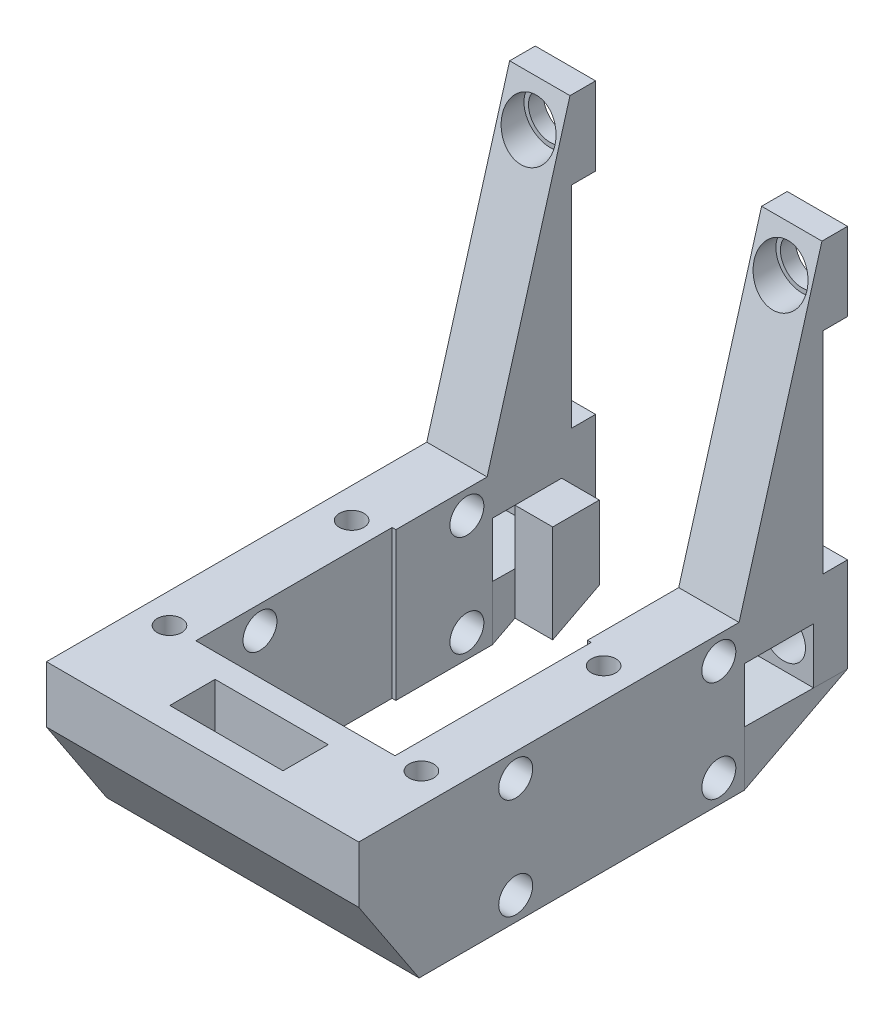
from build123d import *

# Parameters (mm, degrees)
SKETCH1_W             = 7.5
SKETCH1_H             = 7.5
BOSS_EXTRUDE1_DEPTH   = 5.5
BOSS_EXTRUDE1_2_DEPTH = 5.5
BOSS_EXTRUDE1_3_DEPTH = 5.5
BOSS_EXTRUDE1_4_DEPTH = 5.5
BOSS_EXTRUDE2_START   = -5.5
SKETCH2_W             = 8
SKETCH2_H             = 7.5
BOSS_EXTRUDE2_DEPTH   = 50.5
SKETCH3_W             = 41.4
SKETCH3_H             = 7.5
BOSS_EXTRUDE3_DEPTH   = 16
BOSS_EXTRUDE4_DEPTH   = 8
SKETCH5_R             = 2.5
CUT_EXTRUDE1_DEPTH    = 8
SKETCH6_W             = 38.1096
SKETCH6_H             = 12.112327922
BOSS_EXTRUDE6_DEPTH   = 8
SKETCH9_W             = 41.4
SKETCH9_H             = 12.112327922
BOSS_EXTRUDE7_DEPTH   = 8
SKETCH10_R            = 2.25
CUT_EXTRUDE2_DEPTH    = 5606.052393737
BOSS_EXTRUDE8_DEPTH   = 8
BOSS_EXTRUDE9_DEPTH   = 8
SKETCH13_W            = 4.925533285
SKETCH13_H            = 27.926
CUT_EXTRUDE3_DEPTH    = 5606.052393737
BOSS_EXTRUDE10_DEPTH  = 41.4
SKETCH16_W            = 26.4
SKETCH16_H            = 26.013663936
CUT_EXTRUDE5_DEPTH    = 5601.464404158
SKETCH17_W            = 25.4
SKETCH17_H            = 5.5
CUT_EXTRUDE6_DEPTH    = 50
SKETCH18_W            = 41.4
SKETCH18_H            = 1.703308899
CUT_EXTRUDE7_DEPTH    = 50
SKETCH19_R            = 2.9
CUT_EXTRUDE8_DEPTH    = 50
SKETCH20_R            = 3.5
CUT_EXTRUDE9_DEPTH    = 8
SKETCH21_W            = 10.687091101
SKETCH21_H            = 14.528220305
CUT_EXTRUDE10_DEPTH   = 55
SKETCH22_W            = 8
SKETCH22_H            = 4.5
BOSS_EXTRUDE11_DEPTH  = 7.42786537
SKETCH23_R            = 2.9
CUT_EXTRUDE11_DEPTH   = 5
SKETCH25_W            = 6.187091101
SKETCH25_H            = 14.528220305
BOSS_EXTRUDE12_DEPTH  = 5
SKETCH26_W            = 3
SKETCH26_H            = 14.528220305
CUT_EXTRUDE12_DEPTH   = 5606.052393737
BOSS_EXTRUDE15_DEPTH  = 8
CUT_EXTRUDE13_DEPTH   = 5605.999013072
SKETCH29_W            = 15
SKETCH29_H            = 6
CUT_EXTRUDE14_DEPTH   = 10
SKETCH30_R            = 1.625
CUT_EXTRUDE15_DEPTH   = 10
SKETCH31_R            = 1.625
CUT_EXTRUDE16_DEPTH   = 10


with BuildPart() as part:
    # Sketch1 → Boss-Extrude1 (new body)
    with BuildSketch(Plane(origin=(-474.147028746, -1016.113518437, 5527.294851894), x_dir=(1, 0, 0), z_dir=(0, 0, 1))):
        with Locations((215.351694909, 679.332213979)):
            Rectangle(SKETCH1_W, SKETCH1_H)
    extrude(amount=BOSS_EXTRUDE1_DEPTH)

    # Sketch2 → Boss-Extrude2 (add)
    with BuildSketch(Plane.XY.offset(5532.794851894).offset(BOSS_EXTRUDE2_START)):
        with Locations((-233.145333837, -336.781304458)):
            Rectangle(SKETCH2_W, SKETCH2_H)
        with Locations((-266.545333837, -336.781304458)):
            Rectangle(SKETCH2_W, SKETCH2_H)
    boss_extrude2 = extrude(amount=BOSS_EXTRUDE2_DEPTH)


with BuildPart() as body_2:
    # Sketch1 → Boss-Extrude1 2 (new body)
    with BuildSketch(Plane(origin=(-474.147028746, -1016.113518437, 5527.294851894), x_dir=(1, 0, 0), z_dir=(0, 0, 1))):
        with Locations((233.251694909, 679.332213979)):
            Rectangle(SKETCH1_W, SKETCH1_H)
    extrude(amount=BOSS_EXTRUDE1_2_DEPTH)


with BuildPart() as body_3:
    # Sketch1 → Boss-Extrude1 3 (new body)
    with BuildSketch(Plane(origin=(-474.147028746, -1016.113518437, 5527.294851894), x_dir=(1, 0, 0), z_dir=(0, 0, 1))):
        with Locations((233.251694909, 714.758213979)):
            Rectangle(SKETCH1_W, SKETCH1_H)
    extrude(amount=BOSS_EXTRUDE1_3_DEPTH)


with BuildPart() as body_4:
    # Sketch1 → Boss-Extrude1 4 (new body)
    with BuildSketch(Plane(origin=(-474.147028746, -1016.113518437, 5527.294851894), x_dir=(1, 0, 0), z_dir=(0, 0, 1))):
        with Locations((215.351694909, 714.758213979)):
            Rectangle(SKETCH1_W, SKETCH1_H)
    extrude(amount=BOSS_EXTRUDE1_4_DEPTH)



with BuildPart() as boss_extrude2_piece_1:
    # of the separate pieces the step leaves, piece 1, a body of its own (boss_extrude2_pieces)
    add(part.part.solids().sort_by_distance((-255.045333837, -333.031304458, 5527.294851894))[0])



with BuildPart() as boss_extrude2_piece_2:
    # of the separate pieces the step leaves, piece 2, a body of its own (boss_extrude2_pieces)
    add(part.part.solids().sort_by_distance((-229.145333837, -333.031304458, 5527.294851894))[0])


with BuildPart() as boss_extrude2_piece_1_1:
    add(boss_extrude2_piece_1.part)

    add(boss_extrude2_piece_2.part)  # Boss-Extrude3 merges Boss-Extrude2 piece 2
    # Sketch3 → Boss-Extrude3 (add)
    with BuildSketch(Plane.XY.offset(5577.794851894)):
        with Locations((-249.845333837, -336.781304458)):
            Rectangle(SKETCH3_W, SKETCH3_H)
    extrude(amount=BOSS_EXTRUDE3_DEPTH)


with BuildPart() as body_4_1:
    add(body_4.part)

    add(boss_extrude2_piece_1_1.part)  # Boss-Extrude4 merges Boss-Extrude2 piece 1
    # Sketch4 → Boss-Extrude4 (add)
    with BuildSketch(Plane.ZY.offset(262.545333837)):
        Polygon((5527.294851894, -333.031304458), (5527.294851894, -294.74397633), (5532.394065696, -294.74397633), (5543.378858785, -333.031304458), align=None)
    boss_extrude4 = extrude(amount=BOSS_EXTRUDE4_DEPTH)

    # Mirror1: Boss-Extrude2, Boss-Extrude4 across plane
    add(boss_extrude2.mirror(Plane.ZY.offset(249.845333837)))
    add(boss_extrude4.mirror(Plane.ZY.offset(249.845333837)))


with BuildPart() as cut_extrude1_tool:
    # Sketch5 → Cut-Extrude1 (new body)
    with BuildSketch(Plane.XY.offset(5532.794851894)):
        with Locations((-258.795333837, -301.355304458)):
            Circle(SKETCH5_R)
        with Locations((-240.895333837, -301.355304458)):
            Circle(SKETCH5_R)
        with Locations((-240.895333837, -336.781304458)):
            Circle(SKETCH5_R)
        with Locations(Location((-258.795333837, -336.781304458, 0), (0, 0, 180))):
            Circle(SKETCH5_R)
    extrude(amount=-CUT_EXTRUDE1_DEPTH)


with BuildPart() as body_2_1:
    add(body_2.part)

    # Cut-Extrude1: cut by cut_extrude1_tool
    add(cut_extrude1_tool.part, mode=Mode.SUBTRACT)



with BuildPart() as body_3_1:
    add(body_3.part)

    # Cut-Extrude1: cut by cut_extrude1_tool
    add(cut_extrude1_tool.part, mode=Mode.SUBTRACT)


with BuildPart() as body_4_2:
    add(body_4_1.part)

    # Cut-Extrude1: cut by cut_extrude1_tool
    add(cut_extrude1_tool.part, mode=Mode.SUBTRACT)

    # Sketch6 → Boss-Extrude6 (add)
    with BuildSketch(Plane.ZY.offset(270.545333837)):
        with Locations((5558.740051894, -346.587468419)):
            Rectangle(SKETCH6_W, SKETCH6_H)
    boss_extrude6 = extrude(amount=-BOSS_EXTRUDE6_DEPTH)

    # Mirror2: Boss-Extrude6 across plane
    add(boss_extrude6.mirror(Plane.ZY.offset(249.845333837)))

    # Sketch9 → Boss-Extrude7 (add)
    with BuildSketch(Plane.XY.offset(5577.794851894)):
        with Locations((-249.845333837, -346.587468419)):
            Rectangle(SKETCH9_W, SKETCH9_H)
    extrude(amount=BOSS_EXTRUDE7_DEPTH)

    # Sketch10 → Cut-Extrude2 (cut, through all)
    with BuildSketch(Plane.ZY.offset(270.545333837)):
        with Locations((5546.061207304, -349.537271609)):
            Circle(SKETCH10_R)
        with Locations((5572.989599872, -349.537271609)):
            Circle(SKETCH10_R)
        with Locations((5546.061207304, -336.137665229)):
            Circle(SKETCH10_R)
        with Locations((5572.989599872, -336.137665229)):
            Circle(SKETCH10_R)
    extrude(amount=-CUT_EXTRUDE2_DEPTH, mode=Mode.SUBTRACT)

    # Sketch11 → Boss-Extrude8 (add)
    with BuildSketch(Plane.ZY.offset(270.545333837)):
        Polygon((5527.294851894, -340.372465198), (5539.685251894, -352.64363238), (5539.685251894, -340.531304458), align=None)
    extrude(amount=-BOSS_EXTRUDE8_DEPTH)


with BuildPart() as body_2_2:
    add(body_2_1.part)

    add(body_4_2.part)  # Boss-Extrude9 merges body 4
    # Sketch12 → Boss-Extrude9 (add)
    with BuildSketch(Plane(origin=(-229.145333837, 0, 0), x_dir=(0, 0, -1), z_dir=(1, 0, 0))):
        Polygon((-5539.685251894, -352.64363238), (-5531.24028041, -340.531304458), (-5539.685251894, -340.531304458), align=None)
    extrude(amount=-BOSS_EXTRUDE9_DEPTH)

    # Sketch13 → Cut-Extrude3 (cut, through all)
    with BuildSketch(Plane.ZY.offset(270.545333837)):
        with Locations((5529.757618536, -319.068304458)):
            Rectangle(SKETCH13_W, SKETCH13_H)
    extrude(amount=-CUT_EXTRUDE3_DEPTH, mode=Mode.SUBTRACT)

    # Sketch14 → Boss-Extrude10 (add)
    with BuildSketch(Plane.ZY.offset(270.545333837)):
        Polygon((5585.794851894, -352.64363238), (5593.794851894, -340.531304458), (5585.794851894, -340.531304458), align=None)
    extrude(amount=-BOSS_EXTRUDE10_DEPTH)

    # Sketch16 → Cut-Extrude5 (cut, through all)
    with BuildSketch(Plane(origin=(0, -333.031304458, 0), x_dir=(1, 0, 0), z_dir=(0, 1, 0))):
        with Locations((-249.845333837, -5568.481626817)):
            Rectangle(SKETCH16_W, SKETCH16_H)
    extrude(amount=-CUT_EXTRUDE5_DEPTH, mode=Mode.SUBTRACT)


with BuildPart() as cut_extrude6_tool:
    # Sketch17 → Cut-Extrude6 (new body)
    with BuildSketch(Plane(origin=(0, -297.605304458, 0), x_dir=(1, 0, 0), z_dir=(0, 1, 0))):
        with Locations((-249.845333837, -5530.044851894)):
            Rectangle(SKETCH17_W, SKETCH17_H)
    extrude(amount=-CUT_EXTRUDE6_DEPTH)


with BuildPart() as body_2_3:
    add(body_2_2.part)

    # Cut-Extrude6: cut by cut_extrude6_tool
    add(cut_extrude6_tool.part, mode=Mode.SUBTRACT)

    # Sketch18 → Cut-Extrude7 (cut)
    with BuildSketch(Plane(origin=(0, -294.74397633, 0), x_dir=(1, 0, 0), z_dir=(0, 1, 0))):
        with Locations((-249.845333837, -5528.146506344)):
            Rectangle(SKETCH18_W, SKETCH18_H)
    extrude(amount=-CUT_EXTRUDE7_DEPTH, mode=Mode.SUBTRACT)

    # Sketch19 → Cut-Extrude8 (cut)
    with BuildSketch(Plane(origin=(0, 0, 5528.998160793), x_dir=(-1, 0, 0), z_dir=(0, 0, -1))):
        with Locations((233.145333837, -299.924640394)):
            Circle(SKETCH19_R)
    cut_extrude8 = extrude(amount=-CUT_EXTRUDE8_DEPTH, mode=Mode.SUBTRACT)

    # Sketch20 → Cut-Extrude9 (cut)
    with BuildSketch(Plane(origin=(0, 0, 5538.998160793), x_dir=(-1, 0, 0), z_dir=(0, 0, -1))):
        with Locations(Location((233.145333837, -299.924640394, 0), (0, 0, 270))):
            Circle(SKETCH20_R)
    cut_extrude9 = extrude(amount=CUT_EXTRUDE9_DEPTH, mode=Mode.SUBTRACT)

    # Mirror3: Cut-Extrude8, Cut-Extrude9 across plane
    add(cut_extrude8.mirror(Plane.ZY.offset(249.845333837)), mode=Mode.SUBTRACT)
    add(cut_extrude9.mirror(Plane.ZY.offset(249.845333837)), mode=Mode.SUBTRACT)

    # Sketch21 → Cut-Extrude10 (cut)
    with BuildSketch(Plane.ZY.offset(270.545333837)):
        with Locations((5534.341706344, -345.379522228)):
            Rectangle(SKETCH21_W, SKETCH21_H)
    extrude(amount=-CUT_EXTRUDE10_DEPTH, mode=Mode.SUBTRACT)

    # Sketch22 → Boss-Extrude11 (add)
    with BuildSketch(Plane.XZ.offset(338.115412075)):
        with Locations((-266.545333837, 5531.248160793)):
            Rectangle(SKETCH22_W, SKETCH22_H)
    boss_extrude11 = extrude(amount=BOSS_EXTRUDE11_DEPTH)

    # Mirror5: Boss-Extrude11 across plane
    add(boss_extrude11.mirror(Plane.ZY.offset(249.845333837)))

    # Sketch23 → Cut-Extrude11 (cut)
    with BuildSketch(Plane(origin=(0, 0, 5528.998160793), x_dir=(-1, 0, 0), z_dir=(0, 0, -1))):
        with Locations((233.118864035, -341.469886082)):
            Circle(SKETCH23_R)
    cut_extrude11 = extrude(amount=-CUT_EXTRUDE11_DEPTH, mode=Mode.SUBTRACT)

    # Sketch26 → Cut-Extrude12 (cut, through all)
    with BuildSketch(Plane.ZY.offset(270.545333837)):
        with Locations((5541.185251894, -345.379522228)):
            Rectangle(SKETCH26_W, SKETCH26_H)
    extrude(amount=-CUT_EXTRUDE12_DEPTH, mode=Mode.SUBTRACT)

    # Mirror6: Cut-Extrude11 across plane
    add(cut_extrude11.mirror(Plane.ZY.offset(249.845333837)), mode=Mode.SUBTRACT)

    # Sketch29 → Cut-Extrude14 (cut)
    with BuildSketch(Plane(origin=(0, -333.031304458, 0), x_dir=(1, 0, 0), z_dir=(0, 1, 0))):
        with Locations((-249.845333837, -5587.64165534)):
            Rectangle(SKETCH29_W, SKETCH29_H)
    extrude(amount=-CUT_EXTRUDE14_DEPTH, mode=Mode.SUBTRACT)

    # Sketch30 → Cut-Extrude15 (cut)
    with BuildSketch(Plane(origin=(0, -333.031304458, 0), x_dir=(1, 0, 0), z_dir=(0, 1, 0))):
        with Locations(Location((-266.545333837, -5557.335586136, 0), (0, 0, 270))):
            Circle(SKETCH30_R)
    cut_extrude15 = extrude(amount=-CUT_EXTRUDE15_DEPTH, mode=Mode.SUBTRACT)

    # Sketch31 → Cut-Extrude16 (cut)
    with BuildSketch(Plane(origin=(0, -333.031304458, 0), x_dir=(1, 0, 0), z_dir=(0, 1, 0))):
        with Locations(Location((-233.145333837, -5581.488458785, 0), (0, 0, 270))):
            Circle(SKETCH31_R)
    cut_extrude16 = extrude(amount=-CUT_EXTRUDE16_DEPTH, mode=Mode.SUBTRACT)

    # Mirror12: Cut-Extrude15, Cut-Extrude16 across plane
    add(cut_extrude15.mirror(Plane.ZY.offset(249.845333837)), mode=Mode.SUBTRACT)
    add(cut_extrude16.mirror(Plane.ZY.offset(249.845333837)), mode=Mode.SUBTRACT)


with BuildPart() as body_3_2:
    add(body_3_1.part)

    # Cut-Extrude6: cut by cut_extrude6_tool
    add(cut_extrude6_tool.part, mode=Mode.SUBTRACT)


with BuildPart() as body_2_2_1:
    # Sketch25 → Boss-Extrude12 (new body)
    with BuildSketch(Plane(origin=(-262.545333837, 0, 0), x_dir=(0, 0, -1), z_dir=(1, 0, 0))):
        with Locations((-5536.591706344, -345.379522228)):
            Rectangle(SKETCH25_W, SKETCH25_H)
    extrude(amount=BOSS_EXTRUDE12_DEPTH)

    # Sketch28 → Cut-Extrude13 (cut, through all)
    with BuildSketch(Plane.ZY.offset(262.545333837)):
        Polygon((5533.498160793, -347.87771045), (5539.685251894, -351.08734371), (5543.378858785, -359.563611735), (5533.262204425, -359.563611735), align=None)
    extrude(amount=-CUT_EXTRUDE13_DEPTH, mode=Mode.SUBTRACT)


with BuildPart() as body_3_2_1:
    # Sketch27 → Boss-Extrude15 (new body)
    with BuildSketch(Plane.ZY.offset(270.545333837)):
        Polygon((5542.685251894, -352.64363238), (5528.998160793, -345.543277445), (5542.685251894, -345.379522228), align=None)
    extrude(amount=-BOSS_EXTRUDE15_DEPTH)


with BuildPart() as body_4_2_1:
    # Mirror11: mirrored copy
    add(body_2_2_1.part.mirror(Plane.ZY.offset(249.845333837)))


with BuildPart() as body_5:
    # Mirror11 2: mirrored copy
    add(body_3_2_1.part.mirror(Plane.ZY.offset(249.845333837)))


solid = Compound([body_2_3.part, body_2_2_1.part, body_3_2_1.part, body_4_2_1.part, body_5.part])
